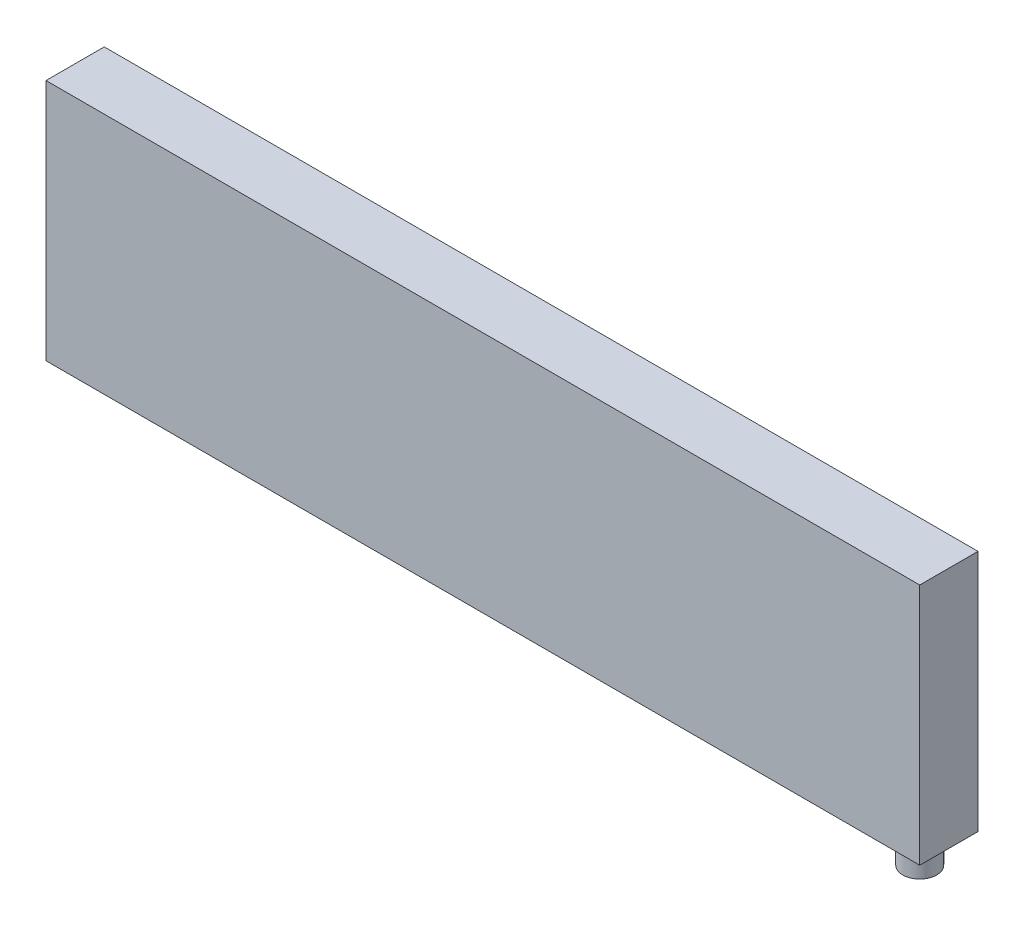
from build123d import *

# Parameters (mm, degrees)
BOSS_EXTRUDE2_DEPTH      = 6
BOSS_EXTRUDE2_DEPTH_BACK = 6
SKETCH1_W                = 180
SKETCH1_H                = 50
SKETCH3_R                = 3.5
BOSS_EXTRUDE3_DEPTH      = 6


with BuildPart() as part:
    # Sketch1 → Boss-Extrude2 (new, two sides: drawn at the far end of the back side and taken through both)
    with BuildSketch(Plane.XY.offset(-BOSS_EXTRUDE2_DEPTH_BACK)):
        Rectangle(SKETCH1_W, SKETCH1_H)
    extrude(amount=BOSS_EXTRUDE2_DEPTH + BOSS_EXTRUDE2_DEPTH_BACK)

    # Sketch3 → Boss-Extrude3 (add)
    with BuildSketch(Plane.XZ.offset(25)):
        with Locations((84, 0)):
            Circle(SKETCH3_R)
    extrude(amount=BOSS_EXTRUDE3_DEPTH)


solid = part.part
